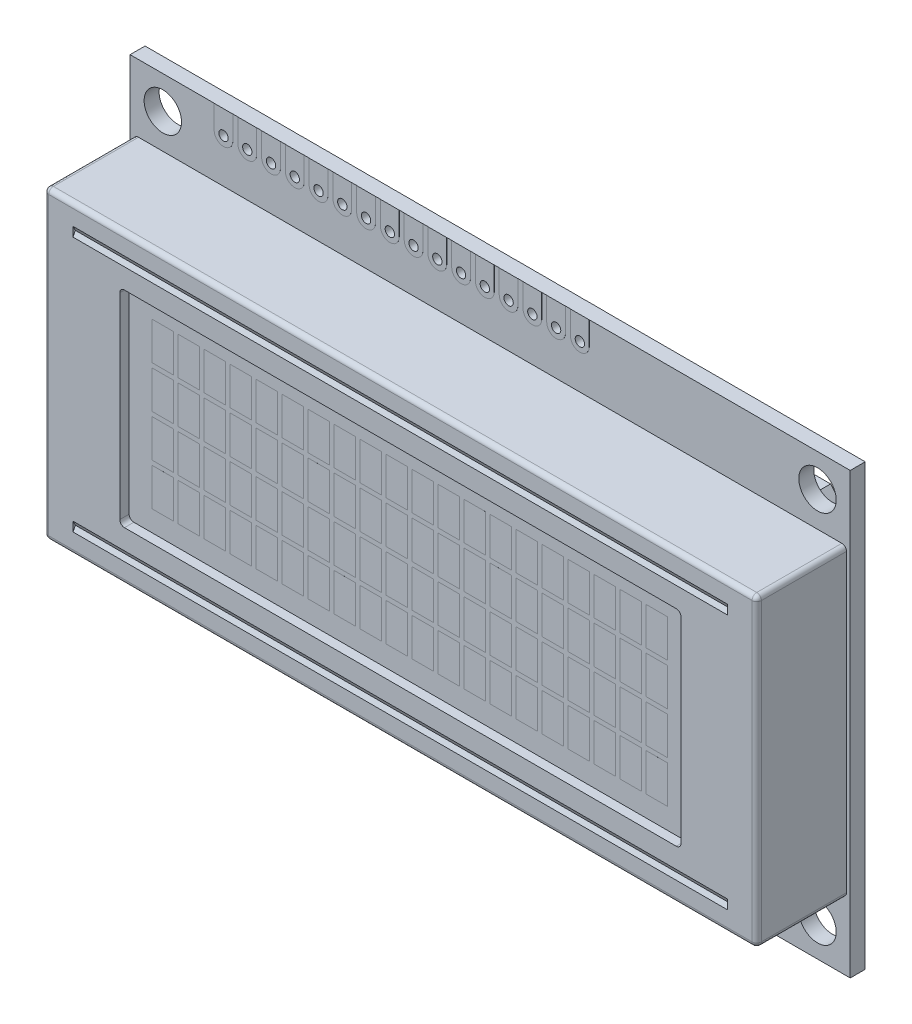
from build123d import *

# Parameters (mm, degrees)
ESQUISSE1_W            = 77
ESQUISSE1_H            = 47
ESQUISSE1_R            = 2
ESQUISSE1_R_2          = 0.5
PCB_DEPTH              = 1.6
ESQUISSE6_R            = 0.5
PADS_DEPTH             = 0.01
ESQUISSE2_W            = 76.2
ESQUISSE2_H            = 32.6
CAPOT_ECRAN_DEPTH      = 9.6
CONG_CAPOT_R           = 0.5
ECRAN_DEPTH            = 1
ESQUISSE4_W            = 2.3
ESQUISSE4_H            = 4.03
CARACTERES_DEPTH       = 0.0001
LIGNES_CAPOT_DEPTH     = 35
LANGUETTES_CAPOT_DEPTH = 3.3


with BuildPart() as part:
    # Esquisse1 → PCB (new body)
    with BuildSketch(Plane.XY):
        Rectangle(ESQUISSE1_W, ESQUISSE1_H)
        with Locations((-35, 20)):
            Circle(ESQUISSE1_R, mode=Mode.SUBTRACT)
        with Locations(Location((35, 20, 0), (0, 0, 180))):
            Circle(ESQUISSE1_R, mode=Mode.SUBTRACT)
        with Locations(Location((-35, -20, 0), (0, 0, 180))):
            Circle(ESQUISSE1_R, mode=Mode.SUBTRACT)
        with Locations((35, -20)):
            Circle(ESQUISSE1_R, mode=Mode.SUBTRACT)
        with Locations((-28.5, 21)):
            Circle(ESQUISSE1_R_2, mode=Mode.SUBTRACT)
        with Locations((-25.96, 21)):
            Circle(ESQUISSE1_R_2, mode=Mode.SUBTRACT)
        with Locations((-23.42, 21)):
            Circle(ESQUISSE1_R_2, mode=Mode.SUBTRACT)
        with Locations((-20.88, 21)):
            Circle(ESQUISSE1_R_2, mode=Mode.SUBTRACT)
        with Locations((-18.34, 21)):
            Circle(ESQUISSE1_R_2, mode=Mode.SUBTRACT)
        with Locations((-15.8, 21)):
            Circle(ESQUISSE1_R_2, mode=Mode.SUBTRACT)
        with Locations((-13.26, 21)):
            Circle(ESQUISSE1_R_2, mode=Mode.SUBTRACT)
        with Locations((-10.72, 21)):
            Circle(ESQUISSE1_R_2, mode=Mode.SUBTRACT)
        with Locations((-8.18, 21)):
            Circle(ESQUISSE1_R_2, mode=Mode.SUBTRACT)
        with Locations((-5.64, 21)):
            Circle(ESQUISSE1_R_2, mode=Mode.SUBTRACT)
        with Locations((-3.1, 21)):
            Circle(ESQUISSE1_R_2, mode=Mode.SUBTRACT)
        with Locations((-0.56, 21)):
            Circle(ESQUISSE1_R_2, mode=Mode.SUBTRACT)
        with Locations((1.98, 21)):
            Circle(ESQUISSE1_R_2, mode=Mode.SUBTRACT)
        with Locations((4.52, 21)):
            Circle(ESQUISSE1_R_2, mode=Mode.SUBTRACT)
        with Locations((7.06, 21)):
            Circle(ESQUISSE1_R_2, mode=Mode.SUBTRACT)
        with Locations((9.6, 21)):
            Circle(ESQUISSE1_R_2, mode=Mode.SUBTRACT)
    extrude(amount=PCB_DEPTH)

    # Esquisse6 → Pads (add)
    # profile 1 of 16: a face of its own
    with BuildSketch(Plane.XY.offset(1.6)):
        with BuildLine():
            Line((-29.5, 21), (-29.5, 23.5))
            Line((-29.5, 23.5), (-27.5, 23.5))
            Line((-27.5, 23.5), (-27.5, 21))
            ThreePointArc((-27.5, 21), (-28.5, 20), (-29.5, 21))
        make_face()
        with Locations((-28.5, 21)):
            Circle(ESQUISSE6_R, mode=Mode.SUBTRACT)
    # profile 2 of 16: a face of its own
    with BuildSketch(Plane.XY.offset(1.6)):
        with BuildLine():
            Line((-24.96, 23.5), (-24.96, 21))
            ThreePointArc((-24.96, 21), (-25.96, 20), (-26.96, 21))
            Line((-26.96, 21), (-26.96, 23.5))
            Line((-26.96, 23.5), (-24.96, 23.5))
        make_face()
        with Locations((-25.96, 21)):
            Circle(ESQUISSE6_R, mode=Mode.SUBTRACT)
    # profile 3 of 16: a face of its own
    with BuildSketch(Plane.XY.offset(1.6)):
        with BuildLine():
            Line((-22.42, 23.5), (-22.42, 21))
            ThreePointArc((-22.42, 21), (-23.42, 20), (-24.42, 21))
            Line((-24.42, 21), (-24.42, 23.5))
            Line((-24.42, 23.5), (-22.42, 23.5))
        make_face()
        with Locations((-23.42, 21)):
            Circle(ESQUISSE6_R, mode=Mode.SUBTRACT)
    # profile 4 of 16: a face of its own
    with BuildSketch(Plane.XY.offset(1.6)):
        with BuildLine():
            Line((-19.88, 23.5), (-19.88, 21))
            ThreePointArc((-19.88, 21), (-20.88, 20), (-21.88, 21))
            Line((-21.88, 21), (-21.88, 23.5))
            Line((-21.88, 23.5), (-19.88, 23.5))
        make_face()
        with Locations((-20.88, 21)):
            Circle(ESQUISSE6_R, mode=Mode.SUBTRACT)
    # profile 5 of 16: a face of its own
    with BuildSketch(Plane.XY.offset(1.6)):
        with BuildLine():
            Line((-17.34, 23.5), (-17.34, 21))
            ThreePointArc((-17.34, 21), (-18.34, 20), (-19.34, 21))
            Line((-19.34, 21), (-19.34, 23.5))
            Line((-19.34, 23.5), (-17.34, 23.5))
        make_face()
        with Locations((-18.34, 21)):
            Circle(ESQUISSE6_R, mode=Mode.SUBTRACT)
    # profile 6 of 16: a face of its own
    with BuildSketch(Plane.XY.offset(1.6)):
        with BuildLine():
            Line((-14.8, 23.5), (-14.8, 21))
            ThreePointArc((-14.8, 21), (-15.8, 20), (-16.8, 21))
            Line((-16.8, 21), (-16.8, 23.5))
            Line((-16.8, 23.5), (-14.8, 23.5))
        make_face()
        with Locations((-15.8, 21)):
            Circle(ESQUISSE6_R, mode=Mode.SUBTRACT)
    # profile 7 of 16: a face of its own
    with BuildSketch(Plane.XY.offset(1.6)):
        with BuildLine():
            Line((-12.26, 23.5), (-12.26, 21))
            ThreePointArc((-12.26, 21), (-13.26, 20), (-14.26, 21))
            Line((-14.26, 21), (-14.26, 23.5))
            Line((-14.26, 23.5), (-12.26, 23.5))
        make_face()
        with Locations((-13.26, 21)):
            Circle(ESQUISSE6_R, mode=Mode.SUBTRACT)
    # profile 8 of 16: a face of its own
    with BuildSketch(Plane.XY.offset(1.6)):
        with BuildLine():
            Line((-9.72, 23.5), (-9.72, 21))
            ThreePointArc((-9.72, 21), (-10.72, 20), (-11.72, 21))
            Line((-11.72, 21), (-11.72, 23.5))
            Line((-11.72, 23.5), (-9.72, 23.5))
        make_face()
        with Locations((-10.72, 21)):
            Circle(ESQUISSE6_R, mode=Mode.SUBTRACT)
    # profile 9 of 16: a face of its own
    with BuildSketch(Plane.XY.offset(1.6)):
        with BuildLine():
            Line((-7.18, 23.5), (-7.18, 21))
            ThreePointArc((-7.18, 21), (-8.18, 20), (-9.18, 21))
            Line((-9.18, 21), (-9.18, 23.5))
            Line((-9.18, 23.5), (-7.18, 23.5))
        make_face()
        with Locations((-8.18, 21)):
            Circle(ESQUISSE6_R, mode=Mode.SUBTRACT)
    # profile 10 of 16: a face of its own
    with BuildSketch(Plane.XY.offset(1.6)):
        with BuildLine():
            Line((-4.64, 23.5), (-4.64, 21))
            ThreePointArc((-4.64, 21), (-5.64, 20), (-6.64, 21))
            Line((-6.64, 21), (-6.64, 23.5))
            Line((-6.64, 23.5), (-4.64, 23.5))
        make_face()
        with Locations((-5.64, 21)):
            Circle(ESQUISSE6_R, mode=Mode.SUBTRACT)
    # profile 11 of 16: a face of its own
    with BuildSketch(Plane.XY.offset(1.6)):
        with BuildLine():
            Line((-2.1, 23.5), (-2.1, 21))
            ThreePointArc((-2.1, 21), (-3.1, 20), (-4.1, 21))
            Line((-4.1, 21), (-4.1, 23.5))
            Line((-4.1, 23.5), (-2.1, 23.5))
        make_face()
        with Locations((-3.1, 21)):
            Circle(ESQUISSE6_R, mode=Mode.SUBTRACT)
    # profile 12 of 16: a face of its own
    with BuildSketch(Plane.XY.offset(1.6)):
        with BuildLine():
            Line((0.44, 23.5), (0.44, 21))
            ThreePointArc((0.44, 21), (-0.56, 20), (-1.56, 21))
            Line((-1.56, 21), (-1.56, 23.5))
            Line((-1.56, 23.5), (0.44, 23.5))
        make_face()
        with Locations((-0.56, 21)):
            Circle(ESQUISSE6_R, mode=Mode.SUBTRACT)
    # profile 13 of 16: a face of its own
    with BuildSketch(Plane.XY.offset(1.6)):
        with BuildLine():
            Line((2.98, 23.5), (2.98, 21))
            ThreePointArc((2.98, 21), (1.98, 20), (0.98, 21))
            Line((0.98, 21), (0.98, 23.5))
            Line((0.98, 23.5), (2.98, 23.5))
        make_face()
        with Locations((1.98, 21)):
            Circle(ESQUISSE6_R, mode=Mode.SUBTRACT)
    # profile 14 of 16: a face of its own
    with BuildSketch(Plane.XY.offset(1.6)):
        with BuildLine():
            Line((5.52, 23.5), (5.52, 21))
            ThreePointArc((5.52, 21), (4.52, 20), (3.52, 21))
            Line((3.52, 21), (3.52, 23.5))
            Line((3.52, 23.5), (5.52, 23.5))
        make_face()
        with Locations((4.52, 21)):
            Circle(ESQUISSE6_R, mode=Mode.SUBTRACT)
    # profile 15 of 16: a face of its own
    with BuildSketch(Plane.XY.offset(1.6)):
        with BuildLine():
            Line((8.06, 23.5), (8.06, 21))
            ThreePointArc((8.06, 21), (7.06, 20), (6.06, 21))
            Line((6.06, 21), (6.06, 23.5))
            Line((6.06, 23.5), (8.06, 23.5))
        make_face()
        with Locations((7.06, 21)):
            Circle(ESQUISSE6_R, mode=Mode.SUBTRACT)
    # profile 16 of 16: a face of its own
    with BuildSketch(Plane.XY.offset(1.6)):
        with BuildLine():
            Line((10.6, 23.5), (10.6, 21))
            ThreePointArc((10.6, 21), (9.6, 20), (8.6, 21))
            Line((8.6, 21), (8.6, 23.5))
            Line((8.6, 23.5), (10.6, 23.5))
        make_face()
        with Locations((9.6, 21)):
            Circle(ESQUISSE6_R, mode=Mode.SUBTRACT)
    pads = extrude(amount=PADS_DEPTH)

    # Symétrie1: Pads across plane
    add(pads.mirror(Plane.XY.offset(0.8)))

    # Esquisse2 → capot ecran (add)
    with BuildSketch(Plane.XY.offset(1.6)):
        Rectangle(ESQUISSE2_W, ESQUISSE2_H)
    extrude(amount=CAPOT_ECRAN_DEPTH)

    # Congé capot
    cong_capot_edges = [part.edges().sort_by_distance(p)[0] for p in [
        (38.1, -16.3, 6.4),
        (38.1, 16.3, 6.4),
        (-38.1, 16.3, 6.4),
        (-38.1, -16.3, 6.4),
        (38.1, 0, 11.2),
        (0, 16.3, 11.2),
        (-38.1, 0, 11.2),
        (0, -16.3, 11.2),
    ]]
    fillet(cong_capot_edges, radius=CONG_CAPOT_R)

    # Esquisse3 → ecran (cut)
    with BuildSketch(Plane.XY.offset(11.2)):
        with BuildLine():
            Line((-29.5, 11), (29.5, 11))
            ThreePointArc((29.5, 11), (29.853553391, 10.853553391), (30, 10.5))
            Line((30, 10.5), (30, -10.5))
            ThreePointArc((30, -10.5), (29.853553391, -10.853553391), (29.5, -11))
            Line((29.5, -11), (-29.5, -11))
            ThreePointArc((-29.5, -11), (-29.853553391, -10.853553391), (-30, -10.5))
            Line((-30, -10.5), (-30, 10.5))
            ThreePointArc((-30, 10.5), (-29.853553391, 10.853553391), (-29.5, 11))
        make_face()
    extrude(amount=-ECRAN_DEPTH, mode=Mode.SUBTRACT)

    # Esquisse4 → caracteres (add)
    with BuildSketch(Plane.XY.offset(10.2)):
        with Locations((-23.63, 6.765)):
            Rectangle(ESQUISSE4_W, ESQUISSE4_H)
        with Locations((-26.41, 6.765)):
            Rectangle(ESQUISSE4_W, ESQUISSE4_H)
        with Locations((-20.85, 6.765)):
            Rectangle(ESQUISSE4_W, ESQUISSE4_H)
        with Locations((-18.07, 6.765)):
            Rectangle(ESQUISSE4_W, ESQUISSE4_H)
        with Locations((-15.29, 6.765)):
            Rectangle(ESQUISSE4_W, ESQUISSE4_H)
        with Locations((-12.51, 6.765)):
            Rectangle(ESQUISSE4_W, ESQUISSE4_H)
        with Locations((-9.73, 6.765)):
            Rectangle(ESQUISSE4_W, ESQUISSE4_H)
        with Locations((-6.95, 6.765)):
            Rectangle(ESQUISSE4_W, ESQUISSE4_H)
        with Locations((-4.17, 6.765)):
            Rectangle(ESQUISSE4_W, ESQUISSE4_H)
        with Locations((-1.39, 6.765)):
            Rectangle(ESQUISSE4_W, ESQUISSE4_H)
        with Locations((1.39, 6.765)):
            Rectangle(ESQUISSE4_W, ESQUISSE4_H)
        with Locations((4.17, 6.765)):
            Rectangle(ESQUISSE4_W, ESQUISSE4_H)
        with Locations((6.95, 6.765)):
            Rectangle(ESQUISSE4_W, ESQUISSE4_H)
        with Locations((9.73, 6.765)):
            Rectangle(ESQUISSE4_W, ESQUISSE4_H)
        with Locations((12.51, 6.765)):
            Rectangle(ESQUISSE4_W, ESQUISSE4_H)
        with Locations((15.29, 6.765)):
            Rectangle(ESQUISSE4_W, ESQUISSE4_H)
        with Locations((18.07, 6.765)):
            Rectangle(ESQUISSE4_W, ESQUISSE4_H)
        with Locations((20.85, 6.765)):
            Rectangle(ESQUISSE4_W, ESQUISSE4_H)
        with Locations((23.63, 6.765)):
            Rectangle(ESQUISSE4_W, ESQUISSE4_H)
        with Locations((26.41, 6.765)):
            Rectangle(ESQUISSE4_W, ESQUISSE4_H)
        with Locations((-23.63, 2.255)):
            Rectangle(ESQUISSE4_W, ESQUISSE4_H)
        with Locations((-20.85, 2.255)):
            Rectangle(ESQUISSE4_W, ESQUISSE4_H)
        with Locations((-18.07, 2.255)):
            Rectangle(ESQUISSE4_W, ESQUISSE4_H)
        with Locations((-15.29, 2.255)):
            Rectangle(ESQUISSE4_W, ESQUISSE4_H)
        with Locations((-12.51, 2.255)):
            Rectangle(ESQUISSE4_W, ESQUISSE4_H)
        with Locations((-9.73, 2.255)):
            Rectangle(ESQUISSE4_W, ESQUISSE4_H)
        with Locations((-6.95, 2.255)):
            Rectangle(ESQUISSE4_W, ESQUISSE4_H)
        with Locations((-4.17, 2.255)):
            Rectangle(ESQUISSE4_W, ESQUISSE4_H)
        with Locations((-1.39, 2.255)):
            Rectangle(ESQUISSE4_W, ESQUISSE4_H)
        with Locations((1.39, 2.255)):
            Rectangle(ESQUISSE4_W, ESQUISSE4_H)
        with Locations((4.17, 2.255)):
            Rectangle(ESQUISSE4_W, ESQUISSE4_H)
        with Locations((6.95, 2.255)):
            Rectangle(ESQUISSE4_W, ESQUISSE4_H)
        with Locations((9.73, 2.255)):
            Rectangle(ESQUISSE4_W, ESQUISSE4_H)
        with Locations((12.51, 2.255)):
            Rectangle(ESQUISSE4_W, ESQUISSE4_H)
        with Locations((15.29, 2.255)):
            Rectangle(ESQUISSE4_W, ESQUISSE4_H)
        with Locations((18.07, 2.255)):
            Rectangle(ESQUISSE4_W, ESQUISSE4_H)
        with Locations((20.85, 2.255)):
            Rectangle(ESQUISSE4_W, ESQUISSE4_H)
        with Locations((23.63, 2.255)):
            Rectangle(ESQUISSE4_W, ESQUISSE4_H)
        with Locations((26.41, 2.255)):
            Rectangle(ESQUISSE4_W, ESQUISSE4_H)
        with Locations((-23.63, -2.255)):
            Rectangle(ESQUISSE4_W, ESQUISSE4_H)
        with Locations((-20.85, -2.255)):
            Rectangle(ESQUISSE4_W, ESQUISSE4_H)
        with Locations((-18.07, -2.255)):
            Rectangle(ESQUISSE4_W, ESQUISSE4_H)
        with Locations((-15.29, -2.255)):
            Rectangle(ESQUISSE4_W, ESQUISSE4_H)
        with Locations((-12.51, -2.255)):
            Rectangle(ESQUISSE4_W, ESQUISSE4_H)
        with Locations((-9.73, -2.255)):
            Rectangle(ESQUISSE4_W, ESQUISSE4_H)
        with Locations((-6.95, -2.255)):
            Rectangle(ESQUISSE4_W, ESQUISSE4_H)
        with Locations((-4.17, -2.255)):
            Rectangle(ESQUISSE4_W, ESQUISSE4_H)
        with Locations((-1.39, -2.255)):
            Rectangle(ESQUISSE4_W, ESQUISSE4_H)
        with Locations((1.39, -2.255)):
            Rectangle(ESQUISSE4_W, ESQUISSE4_H)
        with Locations((4.17, -2.255)):
            Rectangle(ESQUISSE4_W, ESQUISSE4_H)
        with Locations((6.95, -2.255)):
            Rectangle(ESQUISSE4_W, ESQUISSE4_H)
        with Locations((9.73, -2.255)):
            Rectangle(ESQUISSE4_W, ESQUISSE4_H)
        with Locations((12.51, -2.255)):
            Rectangle(ESQUISSE4_W, ESQUISSE4_H)
        with Locations((15.29, -2.255)):
            Rectangle(ESQUISSE4_W, ESQUISSE4_H)
        with Locations((18.07, -2.255)):
            Rectangle(ESQUISSE4_W, ESQUISSE4_H)
        with Locations((20.85, -2.255)):
            Rectangle(ESQUISSE4_W, ESQUISSE4_H)
        with Locations((23.63, -2.255)):
            Rectangle(ESQUISSE4_W, ESQUISSE4_H)
        with Locations((26.41, -2.255)):
            Rectangle(ESQUISSE4_W, ESQUISSE4_H)
        with Locations((-23.63, -6.765)):
            Rectangle(ESQUISSE4_W, ESQUISSE4_H)
        with Locations((-20.85, -6.765)):
            Rectangle(ESQUISSE4_W, ESQUISSE4_H)
        with Locations((-18.07, -6.765)):
            Rectangle(ESQUISSE4_W, ESQUISSE4_H)
        with Locations((-15.29, -6.765)):
            Rectangle(ESQUISSE4_W, ESQUISSE4_H)
        with Locations((-12.51, -6.765)):
            Rectangle(ESQUISSE4_W, ESQUISSE4_H)
        with Locations((-9.73, -6.765)):
            Rectangle(ESQUISSE4_W, ESQUISSE4_H)
        with Locations((-6.95, -6.765)):
            Rectangle(ESQUISSE4_W, ESQUISSE4_H)
        with Locations((-4.17, -6.765)):
            Rectangle(ESQUISSE4_W, ESQUISSE4_H)
        with Locations((-1.39, -6.765)):
            Rectangle(ESQUISSE4_W, ESQUISSE4_H)
        with Locations((1.39, -6.765)):
            Rectangle(ESQUISSE4_W, ESQUISSE4_H)
        with Locations((4.17, -6.765)):
            Rectangle(ESQUISSE4_W, ESQUISSE4_H)
        with Locations((6.95, -6.765)):
            Rectangle(ESQUISSE4_W, ESQUISSE4_H)
        with Locations((9.73, -6.765)):
            Rectangle(ESQUISSE4_W, ESQUISSE4_H)
        with Locations((12.51, -6.765)):
            Rectangle(ESQUISSE4_W, ESQUISSE4_H)
        with Locations((15.29, -6.765)):
            Rectangle(ESQUISSE4_W, ESQUISSE4_H)
        with Locations((18.07, -6.765)):
            Rectangle(ESQUISSE4_W, ESQUISSE4_H)
        with Locations((20.85, -6.765)):
            Rectangle(ESQUISSE4_W, ESQUISSE4_H)
        with Locations((23.63, -6.765)):
            Rectangle(ESQUISSE4_W, ESQUISSE4_H)
        with Locations((26.41, -6.765)):
            Rectangle(ESQUISSE4_W, ESQUISSE4_H)
        with Locations((-26.41, 2.255)):
            Rectangle(ESQUISSE4_W, ESQUISSE4_H)
        with Locations((-26.41, -2.255)):
            Rectangle(ESQUISSE4_W, ESQUISSE4_H)
        with Locations((-26.41, -6.765)):
            Rectangle(ESQUISSE4_W, ESQUISSE4_H)
    extrude(amount=CARACTERES_DEPTH)

    # Esquisse5 → lignes capot (cut, symmetric)
    with BuildSketch(Plane(origin=(0, 0, 0), x_dir=(0, 0, -1), z_dir=(1, 0, 0))):
        Polygon((-11.2, 14.15), (-11.2, 13.15), (-10.95, 13.65), align=None)
        Polygon((-11.2, -14.15), (-11.2, -13.15), (-10.95, -13.65), align=None)
    extrude(amount=LIGNES_CAPOT_DEPTH, both=True, mode=Mode.SUBTRACT)

    # Esquisse7 → languettes capot (add)
    with BuildSketch(Plane(origin=(0, 0, 0), x_dir=(-1, 0, 0), z_dir=(0, 0, -1))):
        Polygon((28.5, -16.3), (28.5, -15.8), (31.26882443, -15.8), (32.119078012, -14.8), (32.5, -15.123880285), (31.5, -16.3), align=None)
        Polygon((11.5, -16.3), (8.5, -16.3), (8.5, -15.8), (11.26882443, -15.8), (12.119078012, -14.8), (12.5, -15.123880285), align=None)
        Polygon((-28.5, -16.3), (-28.5, -15.8), (-31.26882443, -15.8), (-32.119078012, -14.8), (-32.5, -15.123880285), (-31.5, -16.3), align=None)
        Polygon((-8.5, -16.3), (-8.5, -15.8), (-11.26882443, -15.8), (-12.119078012, -14.8), (-12.5, -15.123880285), (-11.5, -16.3), align=None)
        Polygon((-28.5, 15.8), (-31.26882443, 15.8), (-32.119078012, 14.8), (-32.5, 15.123880285), (-31.5, 16.3), (-28.5, 16.3), align=None)
        Polygon((-8.5, 15.8), (-11.26882443, 15.8), (-12.119078012, 14.8), (-12.5, 15.123880285), (-11.5, 16.3), (-8.5, 16.3), align=None)
        Polygon((28.5, 16.3), (28.5, 15.8), (31.26882443, 15.8), (32.119078012, 14.8), (32.5, 15.123880285), (31.5, 16.3), align=None)
        Polygon((8.5, 16.3), (8.5, 15.8), (11.26882443, 15.8), (12.119078012, 14.8), (12.5, 15.123880285), (11.5, 16.3), align=None)
    extrude(amount=LANGUETTES_CAPOT_DEPTH)


solid = part.part
